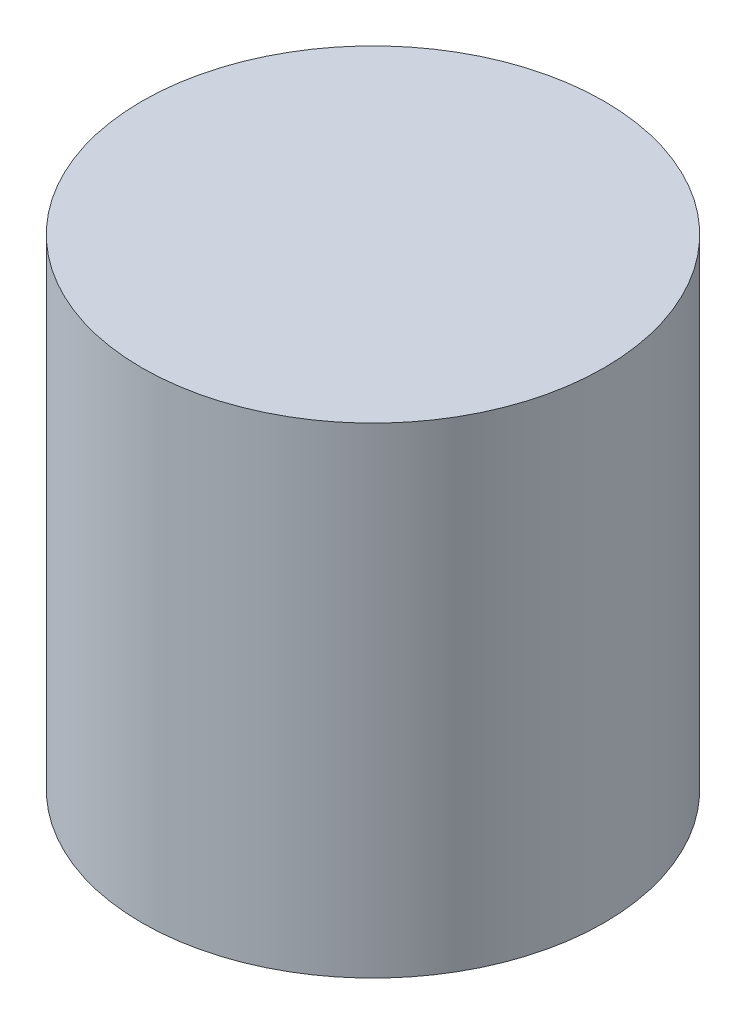
from build123d import *

# Parameters (mm, degrees)
SKETCH1_R           = 24.9
BOSS_EXTRUDE1_DEPTH = 51.8


with BuildPart() as part:
    # Sketch1 → Boss-Extrude1 (new body)
    with BuildSketch(Plane(origin=(0, 0, 0), x_dir=(1, 0, 0), z_dir=(0, 1, 0))):
        with Locations(Location((0, 0, 0), (0, 0, 90))):
            Circle(SKETCH1_R)
    extrude(amount=BOSS_EXTRUDE1_DEPTH)


solid = part.part
